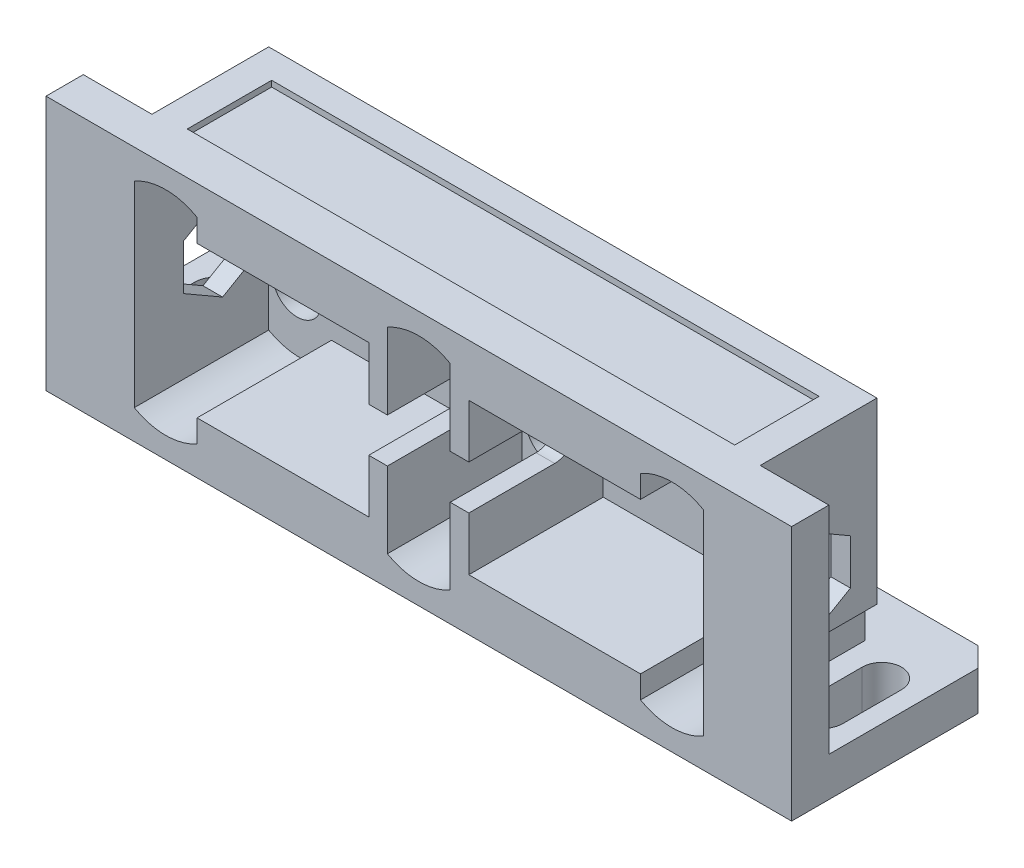
from build123d import *

# Parameters (mm, degrees)
SKETCH1_W           = 76
SKETCH1_H           = 21
BOSS_EXTRUDE1_DEPTH = 4
SKETCH2_W           = 76
SKETCH2_H           = 3.8
BOSS_EXTRUDE2_DEPTH = 26
SKETCH3_W           = 62
SKETCH3_H           = 22
BOSS_EXTRUDE3_DEPTH = 15.7
CHAMFER2_SIZE       = 2
SKETCH4_W           = 55.8
SKETCH4_H           = 8.6
CUT_EXTRUDE1_DEPTH  = 0.6
CUT_EXTRUDE2_DEPTH  = 46.14698218
SKETCH6_W           = 8
SKETCH6_H           = 4
CUT_EXTRUDE3_DEPTH  = 19.7
SKETCH7_W           = 58
SKETCH7_H           = 15.4
CUT_EXTRUDE4_DEPTH  = 13.7
CUT_EXTRUDE5_DEPTH  = 13.7
LPATTERN1_COUNT     = 3
LPATTERN1_PITCH     = 25.8
BOSS_EXTRUDE4_REACH = 52.606
SKETCH9_W           = 1.9
SKETCH9_H           = 15.4
CUT_EXTRUDE6_REACH  = 53.418
CUT_EXTRUDE7_REACH  = 76.48
SKETCH12_W          = 1.2
SKETCH12_H          = 3.8
CUT_EXTRUDE8_DEPTH  = 11.9
CUT_EXTRUDE9_REACH  = 50.647
SKETCH13_R          = 2.5


with BuildPart() as part:
    # Sketch1 → Boss-Extrude1 (new body)
    with BuildSketch(Plane(origin=(0, 0, 0), x_dir=(1, 0, 0), z_dir=(0, 1, 0))):
        Rectangle(SKETCH1_W, SKETCH1_H)
    extrude(amount=BOSS_EXTRUDE1_DEPTH)

    # Sketch2 → Boss-Extrude2 (add)
    with BuildSketch(Plane(origin=(0, 0, 0), x_dir=(1, 0, 0), z_dir=(0, 1, 0))):
        with Locations((0, -8.6)):
            Rectangle(SKETCH2_W, SKETCH2_H)
    extrude(amount=BOSS_EXTRUDE2_DEPTH)

    # Sketch3 → Boss-Extrude3 (add)
    with BuildSketch(Plane(origin=(0, 0, 10.5), x_dir=(-1, 0, 0), z_dir=(0, 0, -1))):
        with Locations((0, 15)):
            Rectangle(SKETCH3_W, SKETCH3_H)
    extrude(amount=BOSS_EXTRUDE3_DEPTH)

    # Chamfer2
    chamfer2_edges = [part.edges().sort_by_distance(p)[0] for p in [
        (-38, 2, -10.5),
        (38, 2, -10.5),
    ]]
    chamfer(chamfer2_edges, length=CHAMFER2_SIZE)

    # Sketch4 → Cut-Extrude1 (cut)
    with BuildSketch(Plane(origin=(0, 26, 0), x_dir=(1, 0, 0), z_dir=(0, 1, 0))):
        with Locations((0, -1.9)):
            Rectangle(SKETCH4_W, SKETCH4_H)
    extrude(amount=-CUT_EXTRUDE1_DEPTH, mode=Mode.SUBTRACT)

    # Sketch5 → Cut-Extrude2 (cut, through all)
    with BuildSketch(Plane(origin=(0, 4, 0), x_dir=(1, 0, 0), z_dir=(0, 1, 0))):
        with BuildLine():
            Line((-32, 2.7), (-32, -3.3))
            ThreePointArc((-32, -3.3), (-34, -5.3), (-36, -3.3))
            Line((-36, -3.3), (-36, 2.7))
            ThreePointArc((-36, 2.7), (-34, 4.7), (-32, 2.7))
        make_face()
        with BuildLine():
            Line((32, 2.7), (32, -3.3))
            ThreePointArc((32, -3.3), (34, -5.3), (36, -3.3))
            Line((36, -3.3), (36, 2.7))
            ThreePointArc((36, 2.7), (34, 4.7), (32, 2.7))
        make_face()
    extrude(amount=-CUT_EXTRUDE2_DEPTH, mode=Mode.SUBTRACT)

    # Sketch6 → Cut-Extrude3 (cut)
    with BuildSketch(Plane(origin=(0, 0, -10.5), x_dir=(-1, 0, 0), z_dir=(0, 0, -1))):
        with Locations((-12.75, 3.1)):
            Rectangle(SKETCH6_W, SKETCH6_H)
        with Locations((12.75, 3.1)):
            Rectangle(SKETCH6_W, SKETCH6_H)
    extrude(amount=-CUT_EXTRUDE3_DEPTH, mode=Mode.SUBTRACT)

    # Sketch7 → Cut-Extrude4 (cut)
    with BuildSketch(Plane.XY.offset(10.5)):
        with Locations((0, 13)):
            Rectangle(SKETCH7_W, SKETCH7_H)
    extrude(amount=-CUT_EXTRUDE4_DEPTH, mode=Mode.SUBTRACT)

    # Sketch8 → Cut-Extrude5 (cut)
    with BuildSketch(Plane.XY.offset(10.5)):
        with BuildLine():
            Line((-29, 23), (-29, 3))
            ThreePointArc((-29, 3), (-25.8, 2.15), (-22.6, 3))
            Line((-22.6, 3), (-22.6, 23))
            ThreePointArc((-22.6, 23), (-25.8, 23.85), (-29, 23))
        make_face()
    cut_extrude5 = extrude(amount=-CUT_EXTRUDE5_DEPTH, mode=Mode.SUBTRACT)

    # LPattern1: Cut-Extrude5 ×3
    with Locations(*[(i * LPATTERN1_PITCH, 0, 0) for i in range(1, LPATTERN1_COUNT)]):
        add(cut_extrude5, mode=Mode.SUBTRACT)

    # Sketch9 → Boss-Extrude4 (add, up to next)
    with BuildSketch(Plane.XY.offset(10.5), mode=Mode.PRIVATE) as boss_extrude4_sk1:
        with Locations((-4.15, 13)):
            Rectangle(SKETCH9_W, SKETCH9_H)
    boss_extrude4_tool1 = extrude(boss_extrude4_sk1.sketch, amount=-BOSS_EXTRUDE4_REACH, mode=Mode.PRIVATE) - part.part
    # Sketch9 → Boss-Extrude4 (add, up to next)
    with BuildSketch(Plane.XY.offset(10.5), mode=Mode.PRIVATE) as boss_extrude4_sk2:
        with Locations((4.15, 13)):
            Rectangle(SKETCH9_W, SKETCH9_H)
    boss_extrude4_tool2 = extrude(boss_extrude4_sk2.sketch, amount=-BOSS_EXTRUDE4_REACH, mode=Mode.PRIVATE) - part.part
    add(boss_extrude4_tool1.solids().sort_by_distance((-4.15, 13, 10.5))[0])
    add(boss_extrude4_tool2.solids().sort_by_distance((4.15, 13, 10.5))[0])

    # Cut-Extrude6: up to this face of the body (flat: up to its plane)
    cut_extrude6_end = Plane(part.part.faces().sort_by_distance((5.1, 13, 3.65))[0])
    # Sketch10 → Cut-Extrude6 (cut, up to the picked face)
    with BuildSketch(Plane.ZY.offset(5.1), mode=Mode.PRIVATE) as cut_extrude6_sk1:
        with BuildLine():
            Line((10.5, 15.25), (1.75, 15.25))
            ThreePointArc((1.75, 15.25), (-0.5, 13), (1.75, 10.75))
            Line((1.75, 10.75), (10.5, 10.75))
            Line((10.5, 10.75), (10.5, 15.25))
        make_face()
    cut_extrude6_tool1 = split(extrude(cut_extrude6_sk1.sketch, amount=-CUT_EXTRUDE6_REACH, mode=Mode.PRIVATE), bisect_by=cut_extrude6_end, keep=Keep.BOTH, mode=Mode.PRIVATE)
    add(cut_extrude6_tool1.solids().sort_by(Axis((-5.1, 13, 5.229437), (1, 0, 0)))[0], mode=Mode.SUBTRACT)

    # Sketch11 → Cut-Extrude7 (cut, up to next)
    with BuildSketch(Plane.ZY.offset(31), mode=Mode.PRIVATE) as cut_extrude7_sk1:
        Polygon((1.5, 17.5), (-2.5, 15.190598923), (-2.5, 10.57179677), (1.5, 8.262395693), (5.5, 10.57179677), (5.5, 15.190598923), align=None)
    cut_extrude7_tool1 = extrude(cut_extrude7_sk1.sketch, amount=-CUT_EXTRUDE7_REACH, mode=Mode.PRIVATE) & part.part
    cut_extrude7 = cut_extrude7_tool1.solids().sort_by_distance((-31, 12.881198, 1.5))[0]
    add(cut_extrude7, mode=Mode.SUBTRACT)

    # Mirror1: Cut-Extrude7 across plane
    add(cut_extrude7.mirror(Plane(origin=(0, 0, 0), x_dir=(0, 0, 1), z_dir=(1, 0, 0))), mode=Mode.SUBTRACT)

    # Sketch12 → Cut-Extrude8 (cut)
    with BuildSketch(Plane(origin=(0, 0, -5.2), x_dir=(-1, 0, 0), z_dir=(0, 0, -1))):
        with Locations((-30.4, 5.9)):
            Rectangle(SKETCH12_W, SKETCH12_H)
        with Locations((30.4, 5.9)):
            Rectangle(SKETCH12_W, SKETCH12_H)
    extrude(amount=-CUT_EXTRUDE8_DEPTH, mode=Mode.SUBTRACT)

    # Sketch13 → Cut-Extrude9 (cut, up to next)
    with BuildSketch(Plane(origin=(0, 0, -5.2), x_dir=(-1, 0, 0), z_dir=(0, 0, -1)), mode=Mode.PRIVATE) as cut_extrude9_sk1:
        with Locations((-25.5, 18.1)):
            Circle(SKETCH13_R)
    cut_extrude9_tool1 = extrude(cut_extrude9_sk1.sketch, amount=-CUT_EXTRUDE9_REACH, mode=Mode.PRIVATE) & part.part
    # Sketch13 → Cut-Extrude9 (cut, up to next)
    with BuildSketch(Plane(origin=(0, 0, -5.2), x_dir=(-1, 0, 0), z_dir=(0, 0, -1)), mode=Mode.PRIVATE) as cut_extrude9_sk2:
        with Locations((0.3, 18.1)):
            Circle(SKETCH13_R)
    cut_extrude9_tool2 = extrude(cut_extrude9_sk2.sketch, amount=-CUT_EXTRUDE9_REACH, mode=Mode.PRIVATE) & part.part
    # Sketch13 → Cut-Extrude9 (cut, up to next)
    with BuildSketch(Plane(origin=(0, 0, -5.2), x_dir=(-1, 0, 0), z_dir=(0, 0, -1)), mode=Mode.PRIVATE) as cut_extrude9_sk3:
        with Locations((26.1, 18.1)):
            Circle(SKETCH13_R)
    cut_extrude9_tool3 = extrude(cut_extrude9_sk3.sketch, amount=-CUT_EXTRUDE9_REACH, mode=Mode.PRIVATE) & part.part
    # Sketch13 → Cut-Extrude9 (cut, up to next)
    with BuildSketch(Plane(origin=(0, 0, -5.2), x_dir=(-1, 0, 0), z_dir=(0, 0, -1)), mode=Mode.PRIVATE) as cut_extrude9_sk4:
        with Locations((0.3, 8.1)):
            Circle(SKETCH13_R)
    cut_extrude9_tool4 = extrude(cut_extrude9_sk4.sketch, amount=-CUT_EXTRUDE9_REACH, mode=Mode.PRIVATE) & part.part
    # Sketch13 → Cut-Extrude9 (cut, up to next)
    with BuildSketch(Plane(origin=(0, 0, -5.2), x_dir=(-1, 0, 0), z_dir=(0, 0, -1)), mode=Mode.PRIVATE) as cut_extrude9_sk5:
        with Locations((26.1, 8.1)):
            Circle(SKETCH13_R)
    cut_extrude9_tool5 = extrude(cut_extrude9_sk5.sketch, amount=-CUT_EXTRUDE9_REACH, mode=Mode.PRIVATE) & part.part
    # Sketch13 → Cut-Extrude9 (cut, up to next)
    with BuildSketch(Plane(origin=(0, 0, -5.2), x_dir=(-1, 0, 0), z_dir=(0, 0, -1)), mode=Mode.PRIVATE) as cut_extrude9_sk6:
        with Locations((-25.5, 8.1)):
            Circle(SKETCH13_R)
    cut_extrude9_tool6 = extrude(cut_extrude9_sk6.sketch, amount=-CUT_EXTRUDE9_REACH, mode=Mode.PRIVATE) & part.part
    add(cut_extrude9_tool1.solids().sort_by_distance((25.5, 18.1, -5.2))[0], mode=Mode.SUBTRACT)
    add(cut_extrude9_tool2.solids().sort_by_distance((-0.3, 18.1, -5.2))[0], mode=Mode.SUBTRACT)
    add(cut_extrude9_tool3.solids().sort_by_distance((-26.1, 18.1, -5.2))[0], mode=Mode.SUBTRACT)
    add(cut_extrude9_tool4.solids().sort_by_distance((-0.3, 8.1, -5.2))[0], mode=Mode.SUBTRACT)
    add(cut_extrude9_tool5.solids().sort_by_distance((-26.1, 8.1, -5.2))[0], mode=Mode.SUBTRACT)
    add(cut_extrude9_tool6.solids().sort_by_distance((25.5, 8.1, -5.2))[0], mode=Mode.SUBTRACT)


solid = part.part
